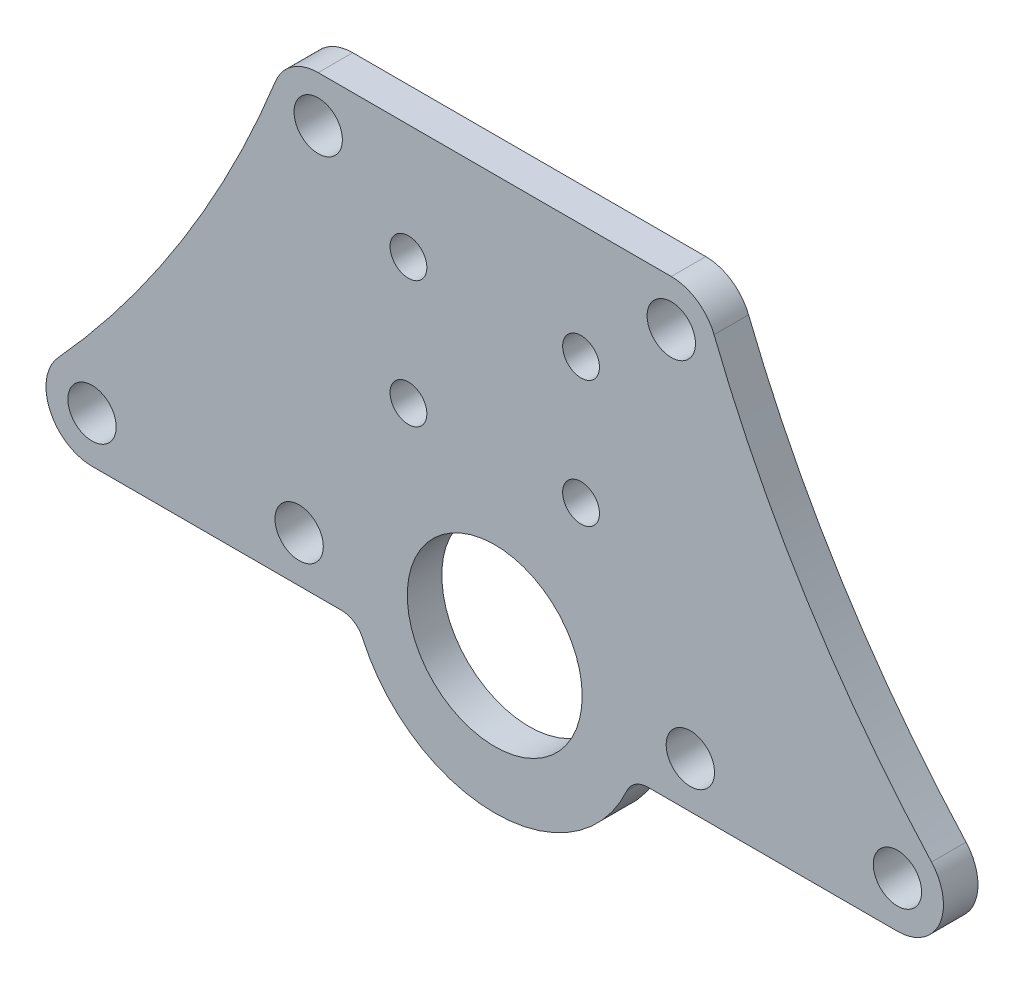
from build123d import *

# Parameters (mm, degrees)
SKETCH_1_R      = 7.6
SKETCH_1_R_2    = 2.1
SKETCH_1_R_3    = 1.6
EXTRUDE_1_DEPTH = 3
FILLET_2_R      = 2


with BuildPart() as part:
    # ｽｹｯﾁ1 → ﾎﾞｽ - 押し出し1 (new body)
    with BuildSketch(Plane.XY):
        with BuildLine():
            ThreePointArc((-37.95979357, -17.309345429), (-38.658047176, -21.61823696), (-35, -24))
            Line((-35, -24), (-11.948221625, -24))
            ThreePointArc((-11.948221625, -24), (0, -32.6), (11.948221625, -24))
            Line((11.948221625, -24), (35, -24))
            ThreePointArc((35, -24), (38.658047176, -21.61823696), (37.95979357, -17.309345429))
            ThreePointArc((37.95979357, -17.309345429), (27.149823207, -3.034907568), (19.058822549, 12.938531129))
            ThreePointArc((19.058822549, 12.938531129), (17.587655142, 14.768604061), (15.342990138, 15.45779162))
            Line((15.342990138, 15.45779162), (-15.342990138, 15.45779162))
            ThreePointArc((-15.342990138, 15.45779162), (-17.587655142, 14.768604061), (-19.058822549, 12.938531129))
            ThreePointArc((-19.058822549, 12.938531129), (-27.149823207, -3.034907568), (-37.95979357, -17.309345429))
        make_face()
        with Locations((0, -20)):
            Circle(SKETCH_1_R, mode=Mode.SUBTRACT)
        with Locations((-35, -20)):
            Circle(SKETCH_1_R_2, mode=Mode.SUBTRACT)
        with Locations((-17, -20)):
            Circle(SKETCH_1_R_2, mode=Mode.SUBTRACT)
        with Locations((-7.5, -5.5)):
            Circle(SKETCH_1_R_3, mode=Mode.SUBTRACT)
        with Locations((17, -20)):
            Circle(SKETCH_1_R_2, mode=Mode.SUBTRACT)
        with Locations((35, -20)):
            Circle(SKETCH_1_R_2, mode=Mode.SUBTRACT)
        with Locations((7.5, -5.5)):
            Circle(SKETCH_1_R_3, mode=Mode.SUBTRACT)
        with Locations((-7.5, 5.5)):
            Circle(SKETCH_1_R_3, mode=Mode.SUBTRACT)
        with Locations((-15.342990138, 11.45779162)):
            Circle(SKETCH_1_R_2, mode=Mode.SUBTRACT)
        with Locations((7.5, 5.5)):
            Circle(SKETCH_1_R_3, mode=Mode.SUBTRACT)
        with Locations((15.342990138, 11.45779162)):
            Circle(SKETCH_1_R_2, mode=Mode.SUBTRACT)
    extrude(amount=EXTRUDE_1_DEPTH)

    # ﾌｨﾚｯﾄ2
    fillet_2_edges = [part.edges().sort_by_distance(p)[0] for p in [
        (-11.948221625, -24, 1.5),
        (11.948221625, -24, 1.5),
    ]]
    fillet(fillet_2_edges, radius=FILLET_2_R)


solid = part.part
